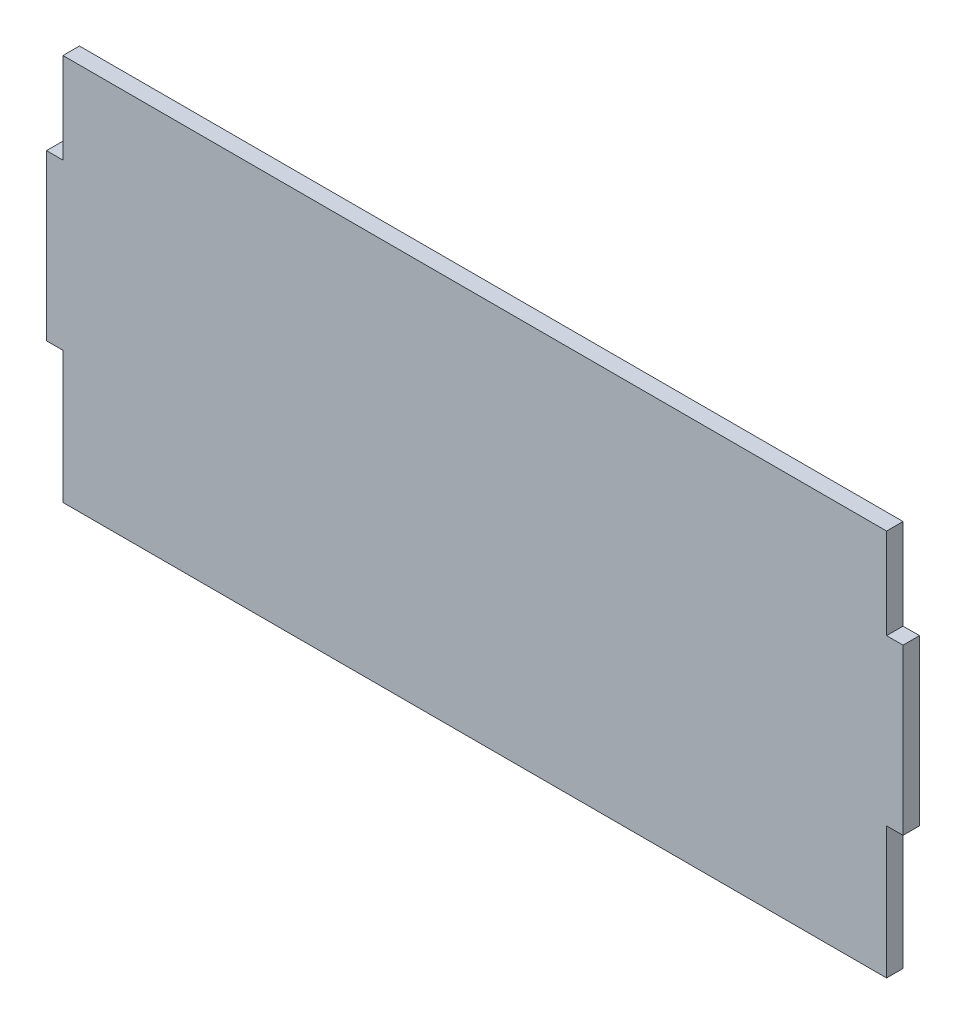
from build123d import *

# Parameters (mm, degrees)
SKETCH_1_W      = 2
SKETCH_1_H      = 20
SKETCH_1_W_2    = 100
SKETCH_1_H_2    = 47
EXTRUDE_1_DEPTH = 2


with BuildPart() as part:
    # Эскиз1 → Бобышка-Вытянуть1 (new body)
    with BuildSketch(Plane.XY):
        with Locations((101, 26)):
            Rectangle(SKETCH_1_W, SKETCH_1_H)
        with Locations((50, 23.5)):
            Rectangle(SKETCH_1_W_2, SKETCH_1_H_2)
        with Locations((-1, 26)):
            Rectangle(SKETCH_1_W, SKETCH_1_H)
    extrude(amount=EXTRUDE_1_DEPTH)


solid = part.part
